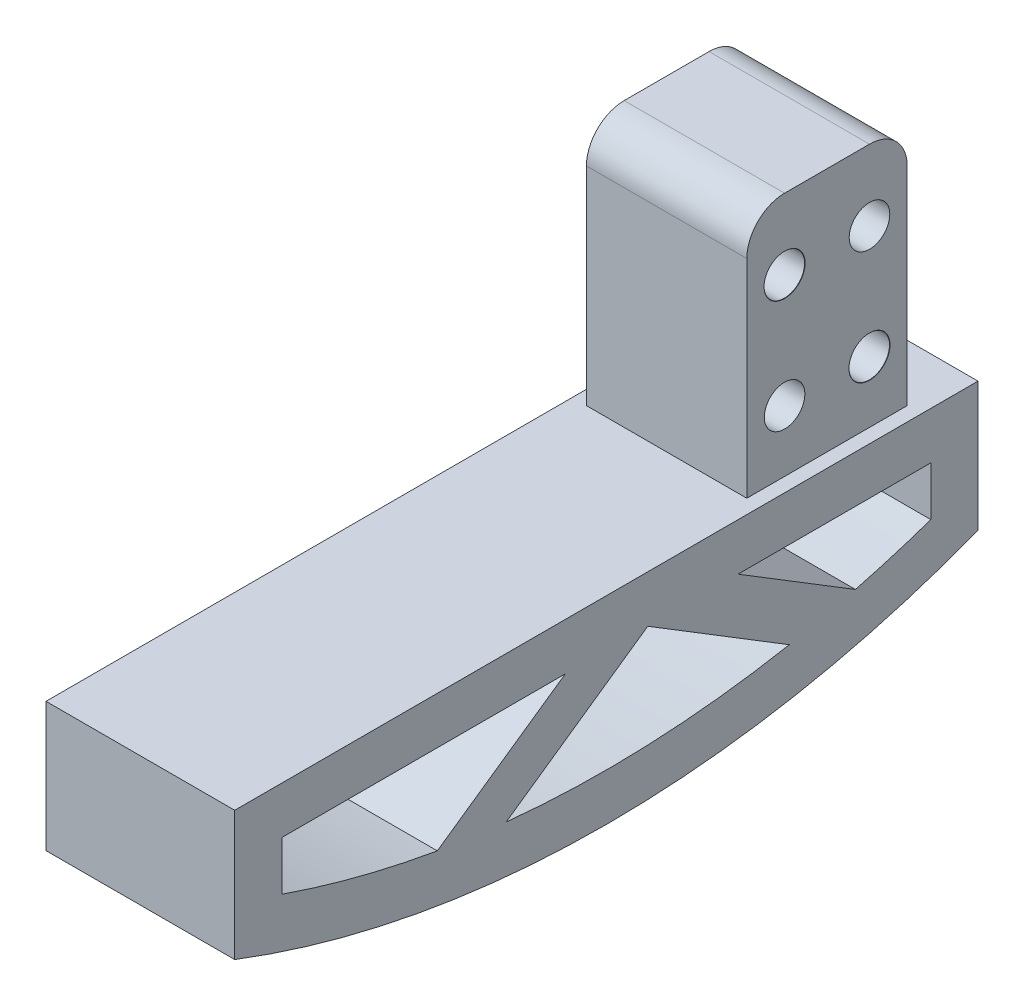
from build123d import *

# Parameters (mm, degrees)
BOSS_EXTRUDE1_DEPTH            = 10
BOSS_EXTRUDE1_DEPTH_BACK       = 10
BOSS_EXTRUDE2_START            = -8.5
BOSS_EXTRUDE2_DEPTH            = 17
M4_CLEARANCE_HOLE1_D           = 4.3
M4_CLEARANCE_HOLE1_CSINK_D     = 4.35
M4_CLEARANCE_HOLE1_CSINK_ANGLE = 90
M4_CLEARANCE_HOLE2_D           = 4.3
M4_CLEARANCE_HOLE2_CSINK_D     = 4.35
M4_CLEARANCE_HOLE2_CSINK_ANGLE = 90
CUT_EXTRUDE1_DEPTH             = 89.78154726
CUT_EXTRUDE1_DEPTH_BACK        = 89.78154726


with BuildPart() as part:
    # Sketch2 → Boss-Extrude1 (new, two sides: drawn at the far end of the back side and taken through both)
    with BuildSketch(Plane(origin=(0, 0, 0), x_dir=(0, 0, -1), z_dir=(1, 0, 0)).offset(-BOSS_EXTRUDE1_DEPTH_BACK)):
        with BuildLine():
            Line((0, 13.70642245), (-6, 13.70642245))
            Line((-6, 13.70642245), (-23, 13.70642245))
            Line((-23, 13.70642245), (-78.775396858, 13.70642245))
            Line((-78.775396858, 13.70642245), (-78.775396858, 0))
            ThreePointArc((-78.775396858, 0), (-59.416347042, -5.45481476), (-39.387698429, -7.29357755))
            ThreePointArc((-39.387698429, -7.29357755), (-19.359049816, -5.45481476), (0, 0))
            Line((0, 0), (0, 13.70642245))
        make_face()
    extrude(amount=BOSS_EXTRUDE1_DEPTH + BOSS_EXTRUDE1_DEPTH_BACK)

    # Sketch2<3> → Boss-Extrude2 (add)
    with BuildSketch(Plane(origin=(0, 0, 0), x_dir=(0, 0, -1), z_dir=(1, 0, 0)).offset(BOSS_EXTRUDE2_START)):
        with BuildLine():
            Line((-23, 13.70642245), (-6, 13.70642245))
            Line((-6, 13.70642245), (-6, 35.706422449))
            ThreePointArc((-6, 35.706422449), (-7.171572875, 38.534849574), (-10, 39.706422449))
            Line((-10, 39.706422449), (-19, 39.706422449))
            ThreePointArc((-19, 39.706422449), (-21.828427125, 38.534849574), (-23, 35.706422449))
            Line((-23, 35.706422449), (-23, 28.706422449))
            Line((-23, 28.706422449), (-23, 23.70642245))
            Line((-23, 23.70642245), (-23, 16.70642245))
            Line((-23, 16.70642245), (-23, 13.70642245))
        make_face()
    extrude(amount=BOSS_EXTRUDE2_DEPTH)

    # M4 Clearance Hole1 (through all)
    with Locations(Plane.ZY.offset(8.5)):
        with Locations((10, 32.206422449), (19, 20.20642245)):
            CounterSinkHole(M4_CLEARANCE_HOLE1_D / 2, M4_CLEARANCE_HOLE1_CSINK_D / 2, counter_sink_angle=M4_CLEARANCE_HOLE1_CSINK_ANGLE)

    # M4 Clearance Hole2 (through all)
    with Locations(Plane(origin=(8.5, 0, 0), x_dir=(0, 0, -1), z_dir=(1, 0, 0))):
        with Locations((-19, 32.206422449), (-10, 20.20642245)):
            CounterSinkHole(M4_CLEARANCE_HOLE2_D / 2, M4_CLEARANCE_HOLE2_CSINK_D / 2, counter_sink_angle=M4_CLEARANCE_HOLE2_CSINK_ANGLE)

    # Sketch8 → Cut-Extrude1 (cut, two sides: drawn at the far end of the back side and taken through both)
    with BuildSketch(Plane(origin=(0, 0, 0), x_dir=(0, 0, -1), z_dir=(1, 0, 0)).offset(-CUT_EXTRUDE1_DEPTH_BACK)):
        with BuildLine():
            Line((-5, 3.497117459), (-5, 8.70642245))
            Line((-5, 8.70642245), (-6, 8.70642245))
            Line((-6, 8.70642245), (-23, 8.70642245))
            Line((-23, 8.70642245), (-25.432523452, 8.70642245))
            Line((-25.432523452, 8.70642245), (-12.989242433, 1.079056445))
            ThreePointArc((-12.989242433, 1.079056445), (-8.970583227, 2.208665745), (-5, 3.497117459))
        make_face()
        with BuildLine():
            ThreePointArc((-39.387698429, -2.29357755), (-29.651907949, -1.841243156), (-20, -0.48813724))
            Line((-20, -0.48813724), (-35, 8.70642245))
            Line((-35, 8.70642245), (-50, -1.755910739))
            ThreePointArc((-50, -1.755910739), (-44.700655003, -2.1590747), (-39.387698429, -2.29357755))
        make_face()
        with BuildLine():
            Line((-57.303381238, -0.753851614), (-43.740048051, 8.70642245))
            Line((-43.740048051, 8.70642245), (-73.775396858, 8.70642245))
            Line((-73.775396858, 8.70642245), (-73.775396858, 3.497117459))
            ThreePointArc((-73.775396858, 3.497117459), (-65.625621494, 1.037492126), (-57.303381238, -0.753851614))
        make_face()
    extrude(amount=CUT_EXTRUDE1_DEPTH + CUT_EXTRUDE1_DEPTH_BACK, mode=Mode.SUBTRACT)


solid = part.part
